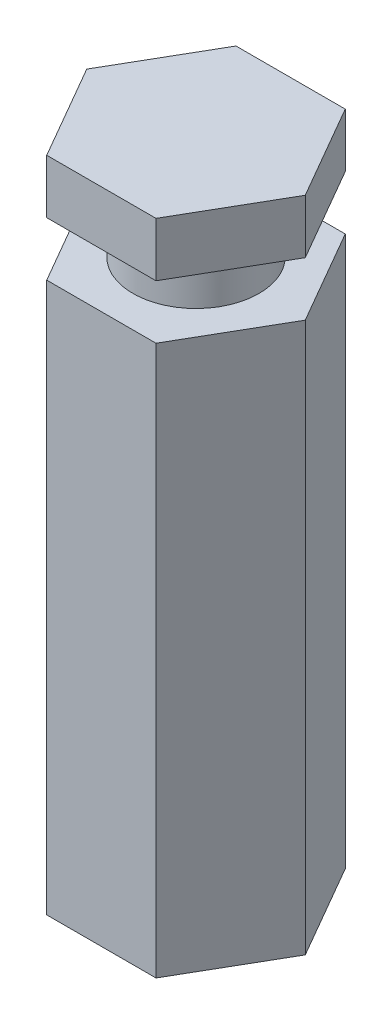
from build123d import *

# Parameters (mm, degrees)
BOSS_EXTRUDE3_DEPTH = 73
SKETCH20_W          = 59.484696614
SKETCH20_H          = 6
CUT_EXTRUDE2_DEPTH  = 73
SKETCH1_5_R         = 7
BOSS_EXTRUDE4_DEPTH = 67


with BuildPart() as part:
    # Sketch1 → Boss-Extrude3 (new body)
    with BuildSketch(Plane(origin=(0, 0, 0), x_dir=(1, 0, 0), z_dir=(0, 1, 0))):
        Polygon((6.062177826, -10.5), (12.124355653, 0), (6.062177826, 10.5), (-6.062177826, 10.5), (-12.124355653, 0), (-6.062177826, -10.5), align=None)
    extrude(amount=BOSS_EXTRUDE3_DEPTH)

    # Sketch20 → Cut-Extrude2 (cut)
    with BuildSketch(Plane(origin=(9.09326674, 0, -5.25), x_dir=(-0.5000000000000012, 0, -0.866025403784438), z_dir=(0.8660254037844379, 0, -0.5000000000000011))):
        with Locations((-0.66768537, 64)):
            Rectangle(SKETCH20_W, SKETCH20_H)
    extrude(amount=-CUT_EXTRUDE2_DEPTH, mode=Mode.SUBTRACT)


with BuildPart() as cut_extrude2_piece_1:
    # of the separate pieces the step leaves, piece 1, a body of its own (cut_extrude2_pieces)
    add(part.part.solids().sort_by_distance((-6.062177826, 0, 10.5))[0])



with BuildPart() as cut_extrude2_piece_2:
    # of the separate pieces the step leaves, piece 2, a body of its own (cut_extrude2_pieces)
    add(part.part.solids().sort_by_distance((6.062177826, 67, 10.5))[0])


with BuildPart() as cut_extrude2_piece_1_1:
    add(cut_extrude2_piece_1.part)

    add(cut_extrude2_piece_2.part)  # Boss-Extrude4 merges Cut-Extrude2 piece 2
    # Sketch1<5> → Boss-Extrude4 (add)
    with BuildSketch(Plane(origin=(0, 0, 0), x_dir=(1, 0, 0), z_dir=(0, 1, 0))):
        Circle(SKETCH1_5_R)
    extrude(amount=BOSS_EXTRUDE4_DEPTH)


solid = cut_extrude2_piece_1_1.part
